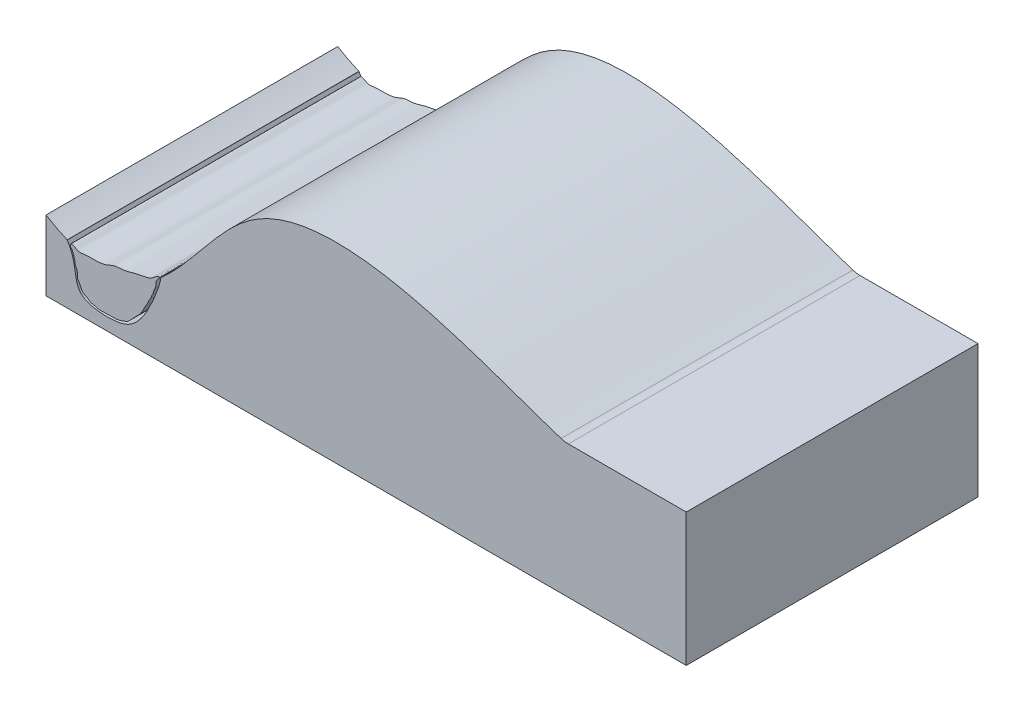
from build123d import *

# Parameters (mm, degrees)
SKETCH1_W            = 390144
SKETCH1_H            = 219456
BOSS_EXTRUDE1_DEPTH  = 163624.768
CUT_EXTRUDE2_DEPTH   = 271472.66
CUT_EXTRUDE3_DEPTH   = 346295.98
BOSS_EXTRUDE10_DEPTH = 217957.146
FILLET2_R            = 381
BOSS_EXTRUDE11_DEPTH = 91440
FILLET5_R            = 17983.2


with BuildPart() as part:
    # Sketch1 → Boss-Extrude1 (new body)
    with BuildSketch(Plane(origin=(0, 0, 0), x_dir=(1, 0, 0), z_dir=(0, 1, 0))):
        with Locations((195072, 109728)):
            Rectangle(SKETCH1_W, SKETCH1_H)
    extrude(amount=BOSS_EXTRUDE1_DEPTH)

    # Sketch3 → Cut-Extrude2 (cut)
    with BuildSketch(Plane.XY):
        with BuildLine():
            Line((0, 163624.768), (0, 52667.881428276))
            add(Edge.make_bspline(
                [(0, 52667.881428276), (83559.657234125, 2393.552459645), (133616.286871643, 210787.472707253), (330012.548128856, 118598.212832559), (390144, 99964.364170083)],
                knots=[0, 0, 0, 0, 0.441082237, 1, 1, 1, 1], degree=3))
            Line((390144, 99964.364170083), (390144, 163624.768))
            Line((390144, 163624.768), (0, 163624.768))
        make_face()
    extrude(amount=-CUT_EXTRUDE2_DEPTH, mode=Mode.SUBTRACT)

    # Sketch5 → Cut-Extrude3 (cut)
    with BuildSketch(Plane.XY):
        with BuildLine():
            add(Edge.make_bspline(
                [(15943.938929574, 44438.801470526), (24000.97956224, 32165.070747339), (17610.944775244, 11877.30092773), (53463.096145325, 7585.183503069), (74840.756530718, 15824.668226501), (91313.903548003, 64441.148914276), (81506.827408491, 54111.260298517), (76367.106638933, 50845.028986764), (68202.503287718, 44982.043979714), (56865.268182729, 41044.130560663), (45351.243870284, 39680.873085513), (35439.52730638, 39718.468582586), (25773.191789485, 42444.451962246), (20914.115902546, 42940.035962595), (14431.749573097, 46625.099297439), (15512.448178871, 45096.114934007), (15943.938929574, 44438.801470526)],
                knots=[0, 0, 0, 0, 0.165559326, 0.282229247, 0.43850359, 0.608520178, 0.616398336, 0.649041552, 0.704919284, 0.771327806, 0.833559197, 0.884172896, 0.927201117, 0.97940914, 0.991133554, 1, 1, 1, 1], degree=3))
        make_face()
    extrude(amount=-CUT_EXTRUDE3_DEPTH, mode=Mode.SUBTRACT)

    # Fillet2
    fillet2_edges = [part.edges().sort_by_distance(p)[0] for p in [
        (86418.162687109, 55180.787024423, -109728.0000003),
        (15943.938929574, 44438.801470526, -109728),
    ]]
    fillet(fillet2_edges, radius=FILLET2_R)

    # 3DSketch1 → Boss-Extrude11 (add)
    with BuildSketch(Plane(origin=(390144, 99964.364170083, 0), x_dir=(0, -0.4145301477800845, -0.9100355798436791), z_dir=(1, 0, 0))):
        Polygon((0, 0), (199712.768210174, 90971.128111226), (241151.010862341, 0), (41438.242652167, -90971.128111226), align=None)
    extrude(amount=BOSS_EXTRUDE11_DEPTH)

    # Fillet5
    fillet5_edges = [part.edges().sort_by_distance(p)[0] for p in [
        (390144, 99964.364170083, -109728),
    ]]
    fillet(fillet5_edges, radius=FILLET5_R)


with BuildPart() as body_2:
    # Sketch7 → Boss-Extrude10 (new body)
    with BuildSketch(Plane.XY):
        with BuildLine():
            add(Edge.make_bspline(
                [(18453.120407378, 42903.994387305), (19279.041164545, 44438.359478442), (23962.754245909, 40353.966510886), (30183.914656624, 41954.918234595), (37537.517540702, 41407.495500827), (45520.141502476, 42410.20608213), (51483.200610616, 45890.303096084), (58555.240721572, 45493.879061531), (65378.152851453, 47875.252739367), (72346.051931403, 49244.943962097), (78836.832862775, 50436.598007467), (81449.834528039, 53125.890760716), (86286.383974804, 55943.792197896), (84079.828947511, 52690.56129342), (82687.650042025, 51130.442240318), (82652.20913462, 48852.613221119), (82536.559461446, 46912.362342799), (81786.181594424, 45027.430478035), (80694.097635989, 43387.664804339), (80640.114672071, 41164.427762298), (79194.093773283, 39860.405658614), (79031.075028234, 37598.474648959), (76995.711930968, 35793.465930894), (76552.993446523, 32965.459192935), (74618.278475675, 30683.643097539), (73690.963861706, 28196.472307104), (72158.783858075, 25747.567848519), (70755.143868881, 23302.313641523), (68431.791849782, 21204.450001992), (66260.075599825, 18679.895994982), (63729.264781367, 16312.874457665), (61435.829477051, 13764.899477549), (57894.769191582, 12644.002904495), (54454.264811842, 11179.532512239), (50672.184607871, 11282.329542294), (47077.013841889, 11118.537392031), (43379.518356676, 11131.82597057), (39786.728131325, 10843.944114795), (36520.911796858, 12108.412372349), (33326.848672141, 12299.978608234), (30638.827239635, 14774.594771298), (27304.713749387, 15781.238439444), (26082.907205575, 19021.382801849), (25051.158302423, 21270.87846555), (23527.988488687, 23006.205473198), (23757.790549199, 24769.522480588), (23527.089533642, 26476.901833534), (23660.244299618, 27985.543393399), (22878.459351482, 28895.86000685), (22873.704039919, 29744.981554663), (22343.211723379, 30428.730568969), (21873.207815252, 31131.155966318), (21931.726002228, 31903.538275755), (22007.164370441, 32713.113522625), (21621.470932193, 33635.479839131), (21460.463807293, 34502.171061317), (21115.263346129, 35254.834259194), (21089.960375994, 36107.525072825), (20759.141933772, 37218.368267333), (20297.875964607, 38469.12161049), (19537.737400256, 39469.763624097), (19282.214559018, 40516.71582602), (18070.786584019, 41127.045518015), (18203.114802691, 42439.543204681), (18453.120407378, 42903.994387305)],
                knots=[0, 0, 0, 0, 0.032228133, 0.056848986, 0.110768164, 0.150328149, 0.188550866, 0.220725386, 0.264216766, 0.305584698, 0.341893531, 0.362147879, 0.381063451, 0.39333657, 0.40506114, 0.419120805, 0.427995913, 0.43740222, 0.452165672, 0.459727907, 0.472635221, 0.481313626, 0.495357933, 0.514511589, 0.52623616, 0.543894958, 0.55783903, 0.573944724, 0.590043718, 0.609107026, 0.628815975, 0.647565392, 0.664217867, 0.689048188, 0.708581162, 0.725775581, 0.748542995, 0.769917086, 0.783892077, 0.805976265, 0.820020572, 0.842967372, 0.858761882, 0.873929096, 0.88476404, 0.894530526, 0.90151416, 0.913734415, 0.917479692, 0.920305405, 0.927164321, 0.931319332, 0.933642054, 0.939681131, 0.944531117, 0.949827738, 0.954234793, 0.95798007, 0.963726166, 0.973302994, 0.979756651, 0.984331883, 0.990244568, 1, 1, 1, 1], degree=3))
        make_face()
    extrude(amount=-BOSS_EXTRUDE10_DEPTH)


solid = Compound([part.part, body_2.part])
